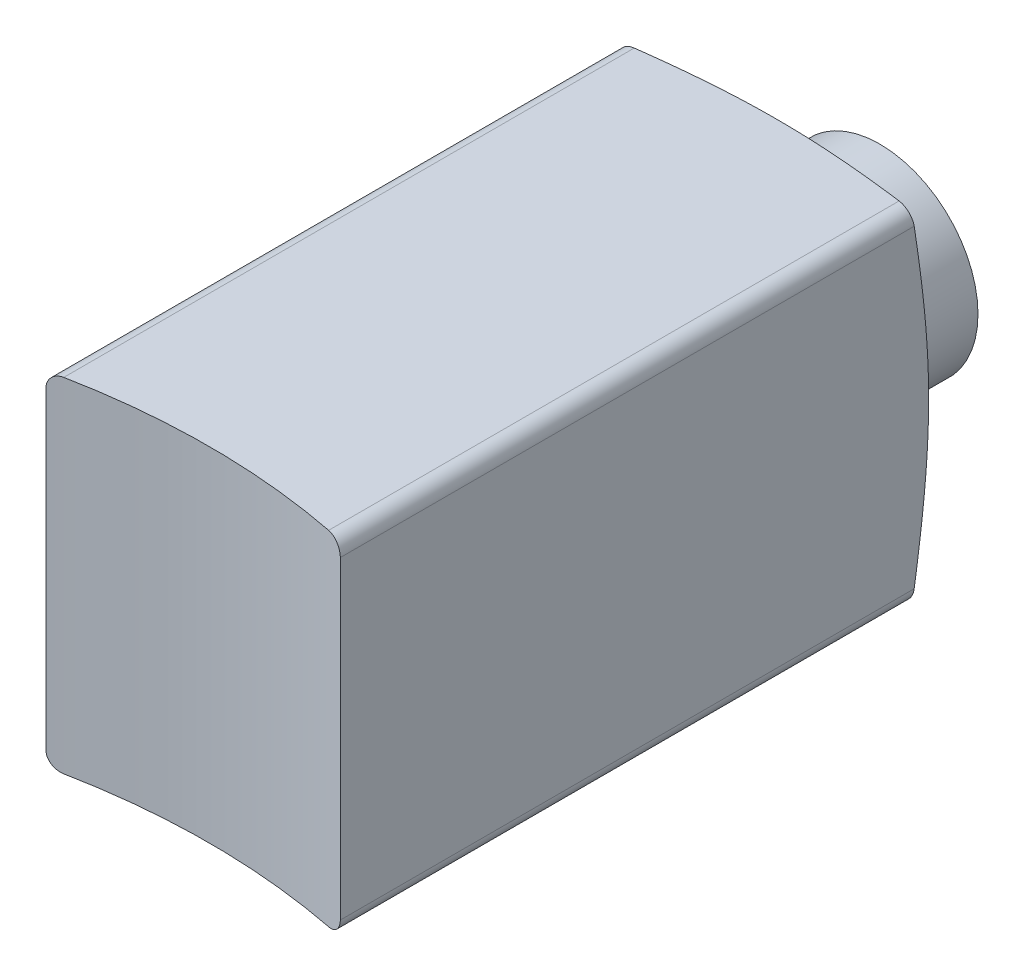
from build123d import *

# Parameters (mm, degrees)
EXTRUSION1_DEPTH        = 12
ENL_V_MAT_EXTRU_1_DEPTH = 6
ESQUISSE3_R             = 2
ESQUISSE3_R_2           = 1
EXTRUSION2_DEPTH        = 2


with BuildPart() as part:
    # Esquisse1 → Extrusion1 (new body)
    with BuildSketch(Plane.XY):
        with BuildLine():
            Line((-2.7, 3.5), (2.7, 3.5))
            ThreePointArc((2.7, 3.5), (2.912132034, 3.412132034), (3, 3.2))
            Line((3, 3.2), (3, -3.2))
            ThreePointArc((3, -3.2), (2.912132034, -3.412132034), (2.7, -3.5))
            Line((2.7, -3.5), (-2.7, -3.5))
            ThreePointArc((-2.7, -3.5), (-2.912132034, -3.412132034), (-3, -3.2))
            Line((-3, -3.2), (-3, 3.2))
            ThreePointArc((-3, 3.2), (-2.912132034, 3.412132034), (-2.7, 3.5))
        make_face()
    extrude(amount=EXTRUSION1_DEPTH)

    # Esquisse2 → Enlèv. mat.-Extru.1 (cut, symmetric)
    with BuildSketch(Plane(origin=(0, 0, 0), x_dir=(1, 0, 0), z_dir=(0, 1, 0))):
        with BuildLine():
            Line((14, -25.674794331), (-14, -25.674794331))
            ThreePointArc((-14, -25.674794331), (0, -11.674794331), (14, -25.674794331))
        make_face()
    extrude(amount=ENL_V_MAT_EXTRU_1_DEPTH, both=True, mode=Mode.SUBTRACT)

    # Esquisse3 → Extrusion2 (add)
    with BuildSketch(Plane(origin=(0, 0, 0), x_dir=(-1, 0, 0), z_dir=(0, 0, -1))):
        with Locations(Location((0, 0, 0), (0, 0, 180))):
            Circle(ESQUISSE3_R)
        Circle(ESQUISSE3_R_2, mode=Mode.SUBTRACT)
    extrude(amount=EXTRUSION2_DEPTH)

    # Esquisse4 → Enlèvement de matière-Révolution1 (revolve, cut)
    with BuildSketch(Plane(origin=(0, 0, 0), x_dir=(1, 0, 0), z_dir=(0, 1, 0)), mode=Mode.PRIVATE) as enl_vement_de_mati_re_r_volution1_sk:
        Polygon((-5.932823797, -0.629669223), (-2.5, 0.1), (-2.5, 1.1), (-5.932823797, 1.1), align=None)
    revolve(enl_vement_de_mati_re_r_volution1_sk.sketch.rotate(Axis((0, 0, 13.123822536), (0, 0, -1)), 180), axis=Axis((0, 0, 13.123822536), (0, 0, -1)), mode=Mode.SUBTRACT)


solid = part.part
